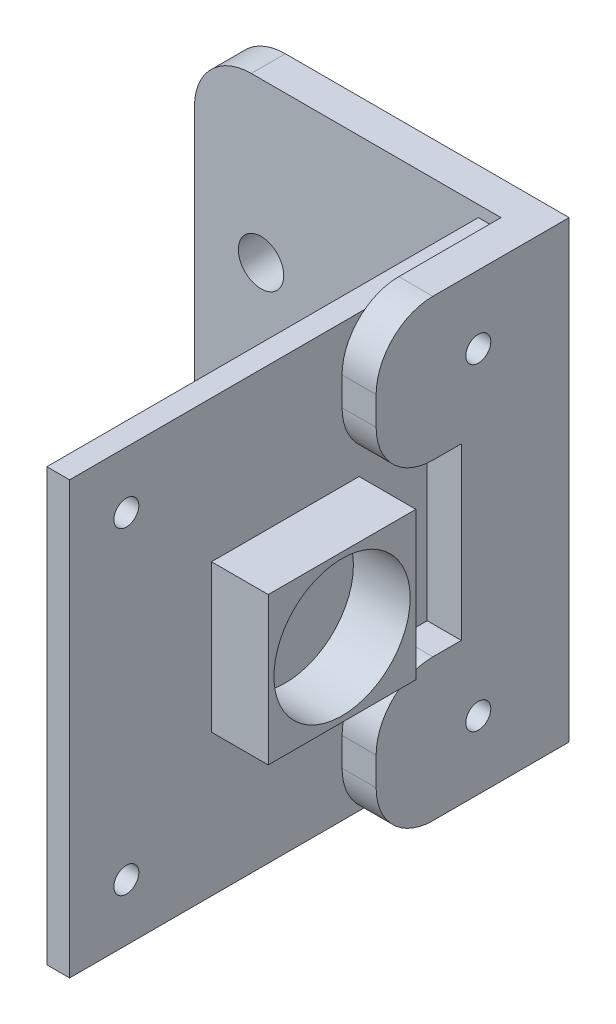
from build123d import *

# Parameters (mm, degrees)
SKETCH1_W           = 38
SKETCH1_H           = 38
SKETCH1_R           = 1.1
BOSS_EXTRUDE1_DEPTH = 2
SKETCH2_R           = 6.5
SKETCH2_R_2         = 6
BOSS_EXTRUDE2_DEPTH = 5
SKETCH3_R           = 1.1
BOSS_EXTRUDE3_DEPTH = 3
SKETCH4_W           = 40
SKETCH4_H           = 3
BOSS_EXTRUDE4_DEPTH = 30
SKETCH5_R           = 2
CUT_EXTRUDE1_DEPTH  = 10
FILLET1_R           = 5


with BuildPart() as part:
    # Sketch1 → Boss-Extrude1 (new body)
    with BuildSketch(Plane.YZ):
        Rectangle(SKETCH1_W, SKETCH1_H)
        with Locations(Location((-14, 14, 0), (0, 0, 270))):
            Circle(SKETCH1_R, mode=Mode.SUBTRACT)
        with Locations(Location((-14, -14, 0), (0, 0, 90))):
            Circle(SKETCH1_R, mode=Mode.SUBTRACT)
        with Locations(Location((14, -14, 0), (0, 0, 270))):
            Circle(SKETCH1_R, mode=Mode.SUBTRACT)
        with Locations(Location((14, 14, 0), (0, 0, 90))):
            Circle(SKETCH1_R, mode=Mode.SUBTRACT)
    extrude(amount=BOSS_EXTRUDE1_DEPTH)

    # Sketch2 → Boss-Extrude2 (add)
    # profile 1 of 5: a face of its own
    with BuildSketch(Plane.YZ.offset(2)):
        with BuildLine():
            Line((-6.5, 6.5), (-6.5, 8e-09))
            ThreePointArc((-6.5, 8e-09), (-4.596194075, 4.596194081), (0, 6.5))
            Line((0, 6.5), (-6.5, 6.5))
        make_face()
    # profile 2 of 5: a face of its own
    with BuildSketch(Plane.YZ.offset(2)):
        with BuildLine():
            ThreePointArc((0, 6.5), (4.596194078, 4.596194078), (6.5, 0))
            Line((6.5, 0), (6.5, 6.5))
            Line((6.5, 6.5), (0, 6.5))
        make_face()
    # profile 3 of 5: a face of its own
    with BuildSketch(Plane.YZ.offset(2)):
        Circle(SKETCH2_R)
        with Locations(Location((0, 0, 0), (0, 0, 270))):
            Circle(SKETCH2_R_2, mode=Mode.SUBTRACT)
    # profile 4 of 5: a face of its own
    with BuildSketch(Plane.YZ.offset(2)):
        with BuildLine():
            ThreePointArc((6.5, 0), (4.596194078, -4.596194078), (0, -6.5))
            Line((0, -6.5), (6.5, -6.5))
            Line((6.5, -6.5), (6.5, 0))
        make_face()
    # profile 5 of 5: a face of its own
    with BuildSketch(Plane.YZ.offset(2)):
        with BuildLine():
            Line((-6.5, 8e-09), (-6.5, -6.5))
            Line((-6.5, -6.5), (0, -6.5))
            ThreePointArc((0, -6.5), (-4.596194081, -4.596194075), (-6.5, 8e-09))
        make_face()
    extrude(amount=BOSS_EXTRUDE2_DEPTH)


with BuildPart() as body_2:
    # Sketch3 → Boss-Extrude3 (new body)
    # profile 1 of 2: a face of its own
    with BuildSketch(Plane.YZ.offset(2)):
        Polygon((19, -5), (7.5, -5), (7.5, -12.5), (-7.5, -12.5), (-7.5, -5), (-19, -5), (-19, -19), (19, -19), align=None)
        with Locations(Location((-14, -14, 0), (0, 0, 270))):
            Circle(SKETCH3_R, mode=Mode.SUBTRACT)
        with Locations(Location((14, -14, 0), (0, 0, 270))):
            Circle(SKETCH3_R, mode=Mode.SUBTRACT)
    # profile 2 of 2: a face of its own
    with BuildSketch(Plane.YZ.offset(2)):
        Polygon((20, -5), (19, -5), (19, -19), (-19, -19), (-19, -5), (-20, -5), (-20, -22), (20, -22), align=None)
    extrude(amount=BOSS_EXTRUDE3_DEPTH)

    # Sketch4 → Boss-Extrude4 (add)
    with BuildSketch(Plane.YZ.offset(5)):
        with Locations((0, -20.5)):
            Rectangle(SKETCH4_W, SKETCH4_H)
    extrude(amount=-BOSS_EXTRUDE4_DEPTH)

    # Sketch5 → Cut-Extrude1 (cut)
    with BuildSketch(Plane.XY.offset(-19)):
        with Locations((-19.135005254, 6)):
            Circle(SKETCH5_R)
        with Locations((-19.135005254, -6)):
            Circle(SKETCH5_R)
    extrude(amount=-CUT_EXTRUDE1_DEPTH, mode=Mode.SUBTRACT)

    # Fillet1
    fillet1_edges = [body_2.edges().sort_by_distance(p)[0] for p in [
        (3.5, 7.5, -5),
        (3.5, 20, -5),
        (3.5, -20, -5),
        (3.5, -7.5, -5),
        (-25, 20, -20.5),
        (-25, -20, -20.5),
    ]]
    fillet(fillet1_edges, radius=FILLET1_R)


solid = Compound([part.part, body_2.part])
